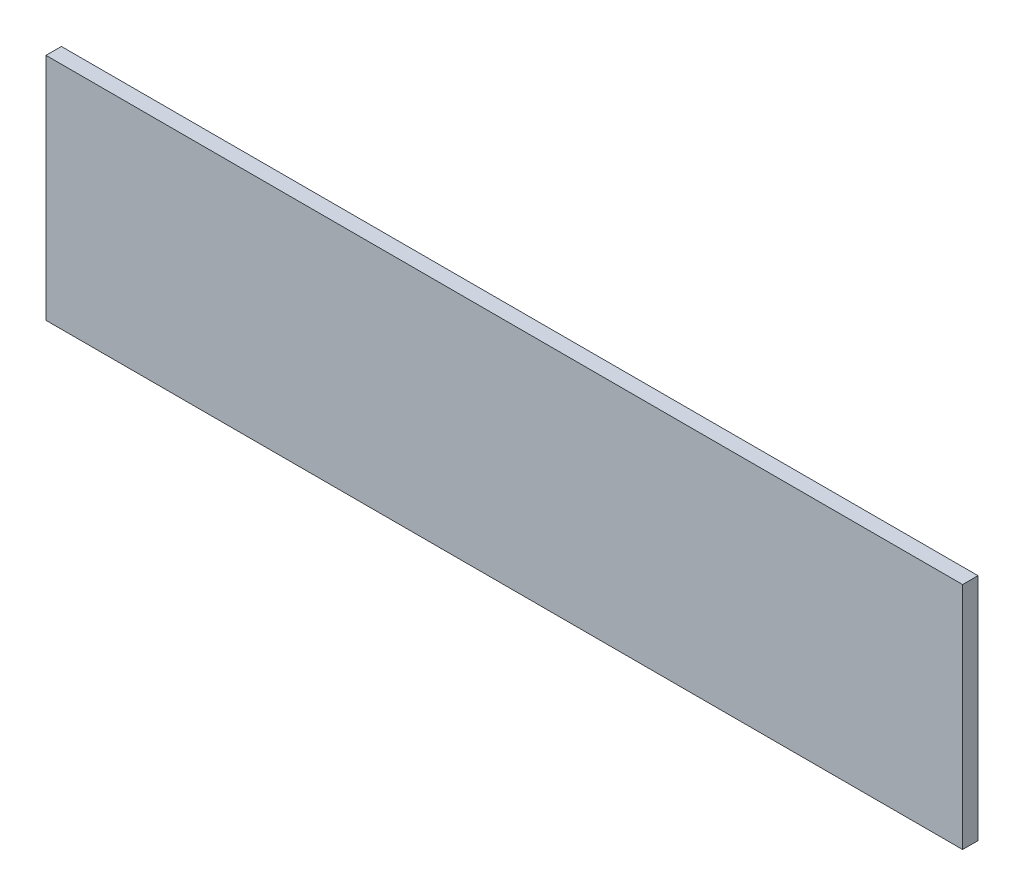
from build123d import *

# Parameters (mm, degrees)
SKETCH1_W           = 80.137
SKETCH1_H           = 20.066
BOSS_EXTRUDE1_DEPTH = 1.3462


with BuildPart() as part:
    # Sketch1 → Boss-Extrude1 (new body)
    with BuildSketch(Plane.XY):
        with Locations((40.0685, 10.033)):
            Rectangle(SKETCH1_W, SKETCH1_H)
    extrude(amount=BOSS_EXTRUDE1_DEPTH)


solid = part.part
